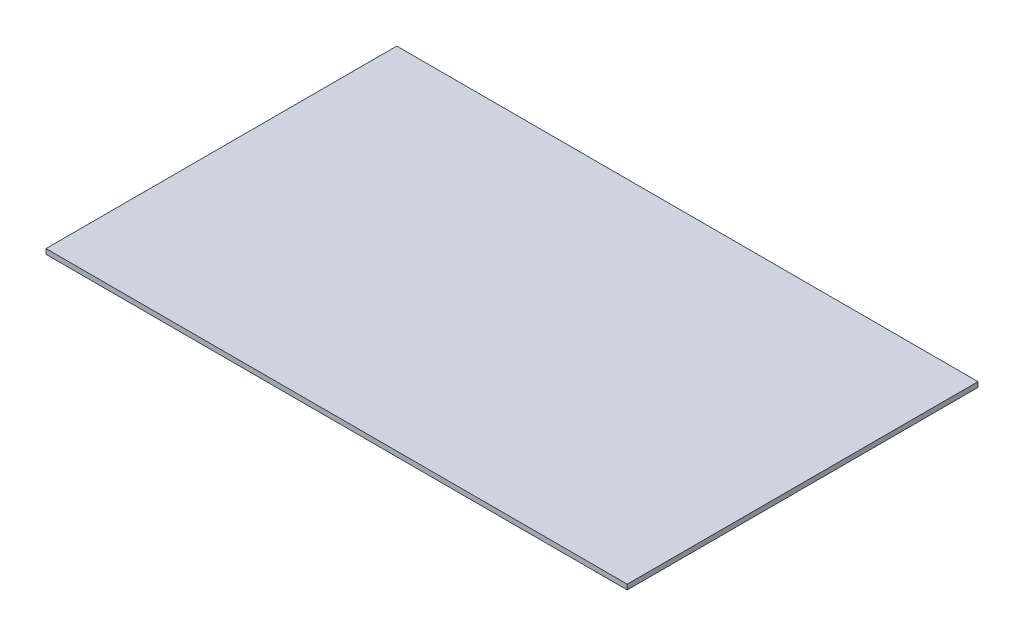
from build123d import *

# Parameters (mm, degrees)
SKETCH1_W           = 116
SKETCH1_H           = 70
BOSS_EXTRUDE1_DEPTH = 1


with BuildPart() as part:
    # Sketch1 → Boss-Extrude1 (new body)
    with BuildSketch(Plane(origin=(0, 0, 0), x_dir=(1, 0, 0), z_dir=(0, 1, 0))):
        with Locations((58, 35)):
            Rectangle(SKETCH1_W, SKETCH1_H)
    extrude(amount=BOSS_EXTRUDE1_DEPTH)


solid = part.part
